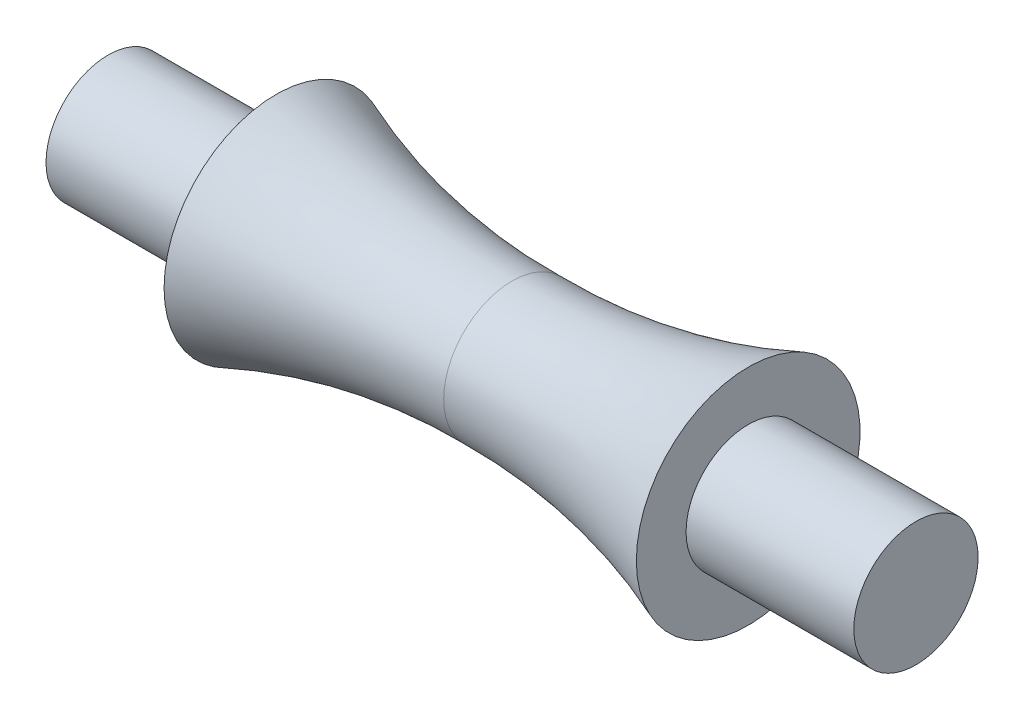
from build123d import *


with BuildPart() as part:
    # Sketch1 → Revolve1 (revolve)
    with BuildSketch(Plane(origin=(0, 0, 0), x_dir=(1, 0, 0), z_dir=(0, 1, 0)), mode=Mode.PRIVATE) as revolve1_sk:
        with BuildLine():
            Line((0, 0), (8.255, 0))
            Line((8.255, 0), (8.255, 1.27))
            Line((8.255, 1.27), (4.826, 1.27))
            Line((4.826, 1.27), (4.826, 2.286))
            ThreePointArc((4.826, 2.286), (2.456346308, 1.606191469), (0, 1.397))
            Line((0, 1.397), (0, 0))
        make_face()
    revolve1 = revolve(revolve1_sk.sketch.rotate(Axis((0, 0, 0), (1, 0, 0)), 180), axis=Axis((0, 0, 0), (1, 0, 0)))

    # Mirror1: Revolve1 across plane
    add(revolve1.mirror(Plane(origin=(0, 0, 0), x_dir=(0, 0, 1), z_dir=(1, 0, 0))))


solid = part.part
